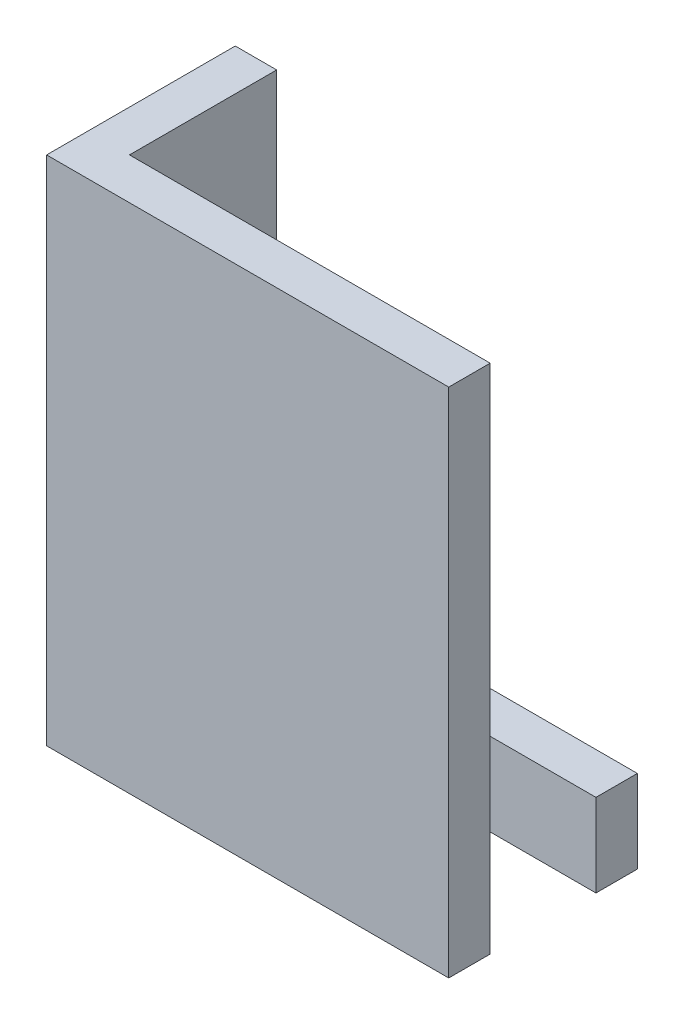
from build123d import *

# Parameters (mm, degrees)
BOSS_EXTRUDE1_DEPTH = 37.06
SKETCH2_W           = 26.12
SKETCH2_H           = 3
BOSS_EXTRUDE2_DEPTH = 6


with BuildPart() as part:
    # Sketch1 → Boss-Extrude1 (new body)
    with BuildSketch(Plane(origin=(0, 0, 0), x_dir=(1, 0, 0), z_dir=(0, 1, 0))):
        Polygon((-2.755107279, -8.58850832), (-2.755107279, -22.24850832), (26.364892721, -22.24850832), (26.364892721, -19.24850832), (0.244892721, -19.24850832), (0.244892721, -8.58850832), align=None)
    extrude(amount=BOSS_EXTRUDE1_DEPTH)

    # Sketch2 → Boss-Extrude2 (add)
    with BuildSketch(Plane(origin=(0, 0, 0), x_dir=(1, 0, 0), z_dir=(0, 1, 0))):
        with Locations((13.304892721, -10.08850832)):
            Rectangle(SKETCH2_W, SKETCH2_H)
    extrude(amount=BOSS_EXTRUDE2_DEPTH)


solid = part.part
